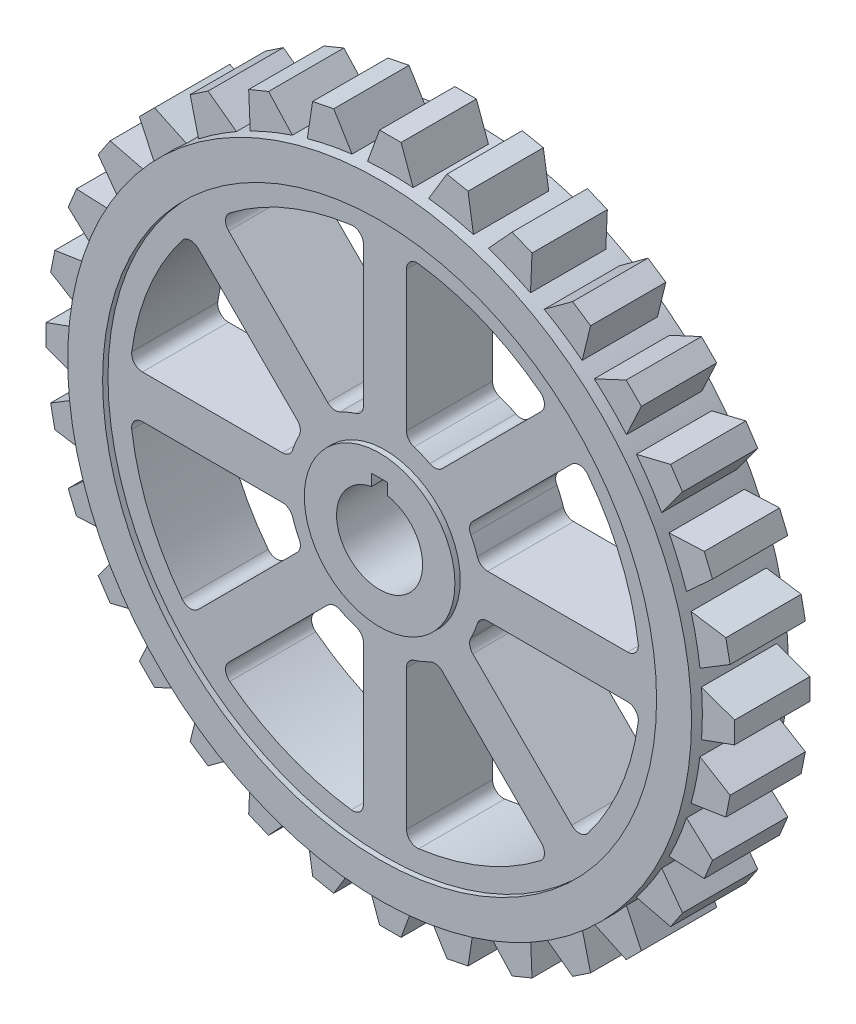
from build123d import *

# Parameters (mm, degrees)
SKETCH1_R           = 58
SKETCH1_R_2         = 51.5
BOSS_EXTRUDE2_DEPTH = 9
SKETCH1_4_R         = 51.5
SKETCH1_4_R_2       = 14
BOSS_EXTRUDE3_DEPTH = 8
SKETCH1_5_R         = 14
BOSS_EXTRUDE4_DEPTH = 9
BOSS_EXTRUDE5_DEPTH = 7
FILLET1_R           = 2


with BuildPart() as part:
    # Sketch1 → Boss-Extrude2 (new, symmetric)
    with BuildSketch(Plane.XY):
        Circle(SKETCH1_R)
        Circle(SKETCH1_R_2, mode=Mode.SUBTRACT)
    extrude(amount=BOSS_EXTRUDE2_DEPTH, both=True)

    # Sketch1<4> → Boss-Extrude3 (add, symmetric)
    with BuildSketch(Plane.XY):
        Circle(SKETCH1_4_R)
        with BuildLine():
            Line((4, 17.549928775), (4, 47.331279298))
            ThreePointArc((4, 47.331279298), (18.177463037, 43.884277794), (30.639841429, 36.296695679))
            Line((30.639841429, 36.296695679), (9.581246521, 15.238100771))
            ThreePointArc((9.581246521, 15.238100771), (6.888301783, 16.629831585), (4, 17.549928775))
        make_face(mode=Mode.SUBTRACT)
        with BuildLine():
            Line((-4, 47.331279298), (-4, 17.549928775))
            ThreePointArc((-4, 17.549928775), (-6.888301783, 16.629831585), (-9.581246521, 15.238100771))
            Line((-9.581246521, 15.238100771), (-30.639841429, 36.296695679))
            ThreePointArc((-30.639841429, 36.296695679), (-18.177463037, 43.884277794), (-4, 47.331279298))
        make_face(mode=Mode.SUBTRACT)
        with BuildLine():
            ThreePointArc((-47.331279298, 4), (-43.884277794, 18.177463037), (-36.296695679, 30.639841429))
            Line((-36.296695679, 30.639841429), (-15.238100771, 9.581246521))
            ThreePointArc((-15.238100771, 9.581246521), (-16.629831585, 6.888301783), (-17.549928775, 4))
            Line((-17.549928775, 4), (-47.331279298, 4))
        make_face(mode=Mode.SUBTRACT)
        with BuildLine():
            ThreePointArc((-36.296695679, -30.639841429), (-43.884277794, -18.177463037), (-47.331279298, -4))
            Line((-47.331279298, -4), (-17.549928775, -4))
            ThreePointArc((-17.549928775, -4), (-16.629831585, -6.888301783), (-15.238100771, -9.581246521))
            Line((-15.238100771, -9.581246521), (-36.296695679, -30.639841429))
        make_face(mode=Mode.SUBTRACT)
        with BuildLine():
            ThreePointArc((-4, -47.331279298), (-18.177463037, -43.884277794), (-30.639841429, -36.296695679))
            Line((-30.639841429, -36.296695679), (-9.581246521, -15.238100771))
            ThreePointArc((-9.581246521, -15.238100771), (-6.888301783, -16.629831585), (-4, -17.549928775))
            Line((-4, -17.549928775), (-4, -47.331279298))
        make_face(mode=Mode.SUBTRACT)
        with BuildLine():
            ThreePointArc((30.639841429, -36.296695679), (18.177463037, -43.884277794), (4, -47.331279298))
            Line((4, -47.331279298), (4, -17.549928775))
            ThreePointArc((4, -17.549928775), (6.888301783, -16.629831585), (9.581246521, -15.238100771))
            Line((9.581246521, -15.238100771), (30.639841429, -36.296695679))
        make_face(mode=Mode.SUBTRACT)
        with BuildLine():
            ThreePointArc((47.331279298, -4), (43.884277794, -18.177463037), (36.296695679, -30.639841429))
            Line((36.296695679, -30.639841429), (15.238100771, -9.581246521))
            ThreePointArc((15.238100771, -9.581246521), (16.629831585, -6.888301783), (17.549928775, -4))
            Line((17.549928775, -4), (47.331279298, -4))
        make_face(mode=Mode.SUBTRACT)
        with BuildLine():
            ThreePointArc((36.296695679, 30.639841429), (43.884277794, 18.177463037), (47.331279298, 4))
            Line((47.331279298, 4), (17.549928775, 4))
            ThreePointArc((17.549928775, 4), (16.629831585, 6.888301783), (15.238100771, 9.581246521))
            Line((15.238100771, 9.581246521), (36.296695679, 30.639841429))
        make_face(mode=Mode.SUBTRACT)
        Circle(SKETCH1_4_R_2, mode=Mode.SUBTRACT)
    extrude(amount=BOSS_EXTRUDE3_DEPTH, both=True)

    # Sketch1<5> → Boss-Extrude4 (add, symmetric)
    with BuildSketch(Plane.XY):
        Circle(SKETCH1_5_R)
        with BuildLine():
            Line((1.5, 10), (1.5, 7.858116823))
            ThreePointArc((1.5, 7.858116823), (0, -8), (-1.5, 7.858116823))
            Line((-1.5, 7.858116823), (-1.5, 10))
            Line((-1.5, 10), (1.5, 10))
        make_face(mode=Mode.SUBTRACT)
    extrude(amount=BOSS_EXTRUDE4_DEPTH, both=True)

    # Sketch4 → Boss-Extrude5 (add, symmetric)
    with BuildSketch(Plane.XY):
        with BuildLine():
            Line((-2, 64), (-4.240313182, 57.844790121))
            ThreePointArc((-4.240313182, 57.844790121), (0, 58), (4.240313182, 57.844790121))
            Line((4.240313182, 57.844790121), (2, 64))
            Line((2, 64), (-2, 64))
        make_face()
        with BuildLine():
            ThreePointArc((-15.443795485, 55.906074634), (-11.315238677, 56.885546263), (-7.126121979, 57.560562763))
            Line((-7.126121979, 57.560562763), (-10.524210048, 63.16043859))
            Line((-10.524210048, 63.16043859), (-14.44735117, 62.380077302))
            Line((-14.44735117, 62.380077302), (-15.443795485, 55.906074634))
        make_face()
        with BuildLine():
            Line((10.524210048, 63.16043859), (7.126121979, 57.560562763))
            ThreePointArc((7.126121979, 57.560562763), (11.315238677, 56.885546263), (15.443795485, 55.906074634))
            Line((15.443795485, 55.906074634), (14.44735117, 62.380077302))
            Line((14.44735117, 62.380077302), (10.524210048, 63.16043859))
        make_face()
        with BuildLine():
            ThreePointArc((-26.053781388, 51.818920052), (-22.195639077, 53.585012886), (-18.218704268, 55.064315258))
            Line((-18.218704268, 55.064315258), (-22.643980606, 59.893656945))
            Line((-22.643980606, 59.893656945), (-26.339498736, 58.362923216))
            Line((-26.339498736, 58.362923216), (-26.053781388, 51.818920052))
        make_face()
        with BuildLine():
            Line((22.643980606, 59.893656945), (18.218704268, 55.064315258))
            ThreePointArc((18.218704268, 55.064315258), (22.195639077, 53.585012886), (26.053781388, 51.818920052))
            Line((26.053781388, 51.818920052), (26.339498736, 58.362923216))
            Line((26.339498736, 58.362923216), (22.643980606, 59.893656945))
        make_face()
        with BuildLine():
            ThreePointArc((-35.662535084, 45.740393433), (-32.223073515, 48.225237514), (-28.611151969, 50.451976998))
            Line((-28.611151969, 50.451976998), (-33.893555689, 54.325195653))
            Line((-33.893555689, 54.325195653), (-37.219434138, 52.102914721))
            Line((-37.219434138, 52.102914721), (-35.662535084, 45.740393433))
        make_face()
        with BuildLine():
            Line((33.893555689, 54.325195653), (28.611151969, 50.451976998))
            ThreePointArc((28.611151969, 50.451976998), (32.223073515, 48.225237514), (35.662535084, 45.740393433))
            Line((35.662535084, 45.740393433), (37.219434138, 52.102914721))
            Line((37.219434138, 52.102914721), (33.893555689, 54.325195653))
        make_face()
        with BuildLine():
            ThreePointArc((-43.900797556, 37.904089146), (-41.012193309, 41.012193309), (-37.904089146, 43.900797556))
            Line((-37.904089146, 43.900797556), (-43.840620434, 46.669047558))
            Line((-43.840620434, 46.669047558), (-46.669047558, 43.840620434))
            Line((-46.669047558, 43.840620434), (-43.900797556, 37.904089146))
        make_face()
        with BuildLine():
            Line((43.840620434, 46.669047558), (37.904089146, 43.900797556))
            ThreePointArc((37.904089146, 43.900797556), (41.012193309, 41.012193309), (43.900797556, 37.904089146))
            Line((43.900797556, 37.904089146), (46.669047558, 43.840620434))
            Line((46.669047558, 43.840620434), (43.840620434, 46.669047558))
        make_face()
        with BuildLine():
            ThreePointArc((-50.451976998, 28.611151969), (-48.225237514, 32.223073515), (-45.740393433, 35.662535084))
            Line((-45.740393433, 35.662535084), (-52.102914721, 37.219434138))
            Line((-52.102914721, 37.219434138), (-54.325195653, 33.893555689))
            Line((-54.325195653, 33.893555689), (-50.451976998, 28.611151969))
        make_face()
        with BuildLine():
            Line((52.102914721, 37.219434138), (45.740393433, 35.662535084))
            ThreePointArc((45.740393433, 35.662535084), (48.225237514, 32.223073515), (50.451976998, 28.611151969))
            Line((50.451976998, 28.611151969), (54.325195653, 33.893555689))
            Line((54.325195653, 33.893555689), (52.102914721, 37.219434138))
        make_face()
        with BuildLine():
            ThreePointArc((-55.064315258, 18.218704268), (-53.585012886, 22.195639077), (-51.818920052, 26.053781388))
            Line((-51.818920052, 26.053781388), (-58.362923216, 26.339498736))
            Line((-58.362923216, 26.339498736), (-59.893656945, 22.643980606))
            Line((-59.893656945, 22.643980606), (-55.064315258, 18.218704268))
        make_face()
        with BuildLine():
            Line((58.362923216, 26.339498736), (51.818920052, 26.053781388))
            ThreePointArc((51.818920052, 26.053781388), (53.585012886, 22.195639077), (55.064315258, 18.218704268))
            Line((55.064315258, 18.218704268), (59.893656945, 22.643980606))
            Line((59.893656945, 22.643980606), (58.362923216, 26.339498736))
        make_face()
        with BuildLine():
            ThreePointArc((-57.560562763, 7.126121979), (-56.885546263, 11.315238677), (-55.906074634, 15.443795485))
            Line((-55.906074634, 15.443795485), (-62.380077302, 14.44735117))
            Line((-62.380077302, 14.44735117), (-63.16043859, 10.524210048))
            Line((-63.16043859, 10.524210048), (-57.560562763, 7.126121979))
        make_face()
        with BuildLine():
            Line((62.380077302, 14.44735117), (55.906074634, 15.443795485))
            ThreePointArc((55.906074634, 15.443795485), (56.885546263, 11.315238677), (57.560562763, 7.126121979))
            Line((57.560562763, 7.126121979), (63.16043859, 10.524210048))
            Line((63.16043859, 10.524210048), (62.380077302, 14.44735117))
        make_face()
        with BuildLine():
            ThreePointArc((-57.844790121, -4.240313182), (-58, 0), (-57.844790121, 4.240313182))
            Line((-57.844790121, 4.240313182), (-64, 2))
            Line((-64, 2), (-64, -2))
            Line((-64, -2), (-57.844790121, -4.240313182))
        make_face()
        with BuildLine():
            Line((64, 2), (57.844790121, 4.240313182))
            ThreePointArc((57.844790121, 4.240313182), (58, 0), (57.844790121, -4.240313182))
            Line((57.844790121, -4.240313182), (64, -2))
            Line((64, -2), (64, 2))
        make_face()
        with BuildLine():
            ThreePointArc((-55.906074634, -15.443795485), (-56.885546263, -11.315238677), (-57.560562763, -7.126121979))
            Line((-57.560562763, -7.126121979), (-63.16043859, -10.524210048))
            Line((-63.16043859, -10.524210048), (-62.380077302, -14.44735117))
            Line((-62.380077302, -14.44735117), (-55.906074634, -15.443795485))
        make_face()
        with BuildLine():
            Line((63.16043859, -10.524210048), (57.560562763, -7.126121979))
            ThreePointArc((57.560562763, -7.126121979), (56.885546263, -11.315238677), (55.906074634, -15.443795485))
            Line((55.906074634, -15.443795485), (62.380077302, -14.44735117))
            Line((62.380077302, -14.44735117), (63.16043859, -10.524210048))
        make_face()
        with BuildLine():
            ThreePointArc((-51.818920052, -26.053781388), (-53.585012886, -22.195639077), (-55.064315258, -18.218704268))
            Line((-55.064315258, -18.218704268), (-59.893656945, -22.643980606))
            Line((-59.893656945, -22.643980606), (-58.362923216, -26.339498736))
            Line((-58.362923216, -26.339498736), (-51.818920052, -26.053781388))
        make_face()
        with BuildLine():
            Line((59.893656945, -22.643980606), (55.064315258, -18.218704268))
            ThreePointArc((55.064315258, -18.218704268), (53.585012886, -22.195639077), (51.818920052, -26.053781388))
            Line((51.818920052, -26.053781388), (58.362923216, -26.339498736))
            Line((58.362923216, -26.339498736), (59.893656945, -22.643980606))
        make_face()
        with BuildLine():
            ThreePointArc((-45.740393433, -35.662535084), (-48.225237514, -32.223073515), (-50.451976998, -28.611151969))
            Line((-50.451976998, -28.611151969), (-54.325195653, -33.893555689))
            Line((-54.325195653, -33.893555689), (-52.102914721, -37.219434138))
            Line((-52.102914721, -37.219434138), (-45.740393433, -35.662535084))
        make_face()
        with BuildLine():
            Line((54.325195653, -33.893555689), (50.451976998, -28.611151969))
            ThreePointArc((50.451976998, -28.611151969), (48.225237514, -32.223073515), (45.740393433, -35.662535084))
            Line((45.740393433, -35.662535084), (52.102914721, -37.219434138))
            Line((52.102914721, -37.219434138), (54.325195653, -33.893555689))
        make_face()
        with BuildLine():
            ThreePointArc((-37.904089146, -43.900797556), (-41.012193309, -41.012193309), (-43.900797556, -37.904089146))
            Line((-43.900797556, -37.904089146), (-46.669047558, -43.840620434))
            Line((-46.669047558, -43.840620434), (-43.840620434, -46.669047558))
            Line((-43.840620434, -46.669047558), (-37.904089146, -43.900797556))
        make_face()
        with BuildLine():
            Line((46.669047558, -43.840620434), (43.900797556, -37.904089146))
            ThreePointArc((43.900797556, -37.904089146), (41.012193309, -41.012193309), (37.904089146, -43.900797556))
            Line((37.904089146, -43.900797556), (43.840620434, -46.669047558))
            Line((43.840620434, -46.669047558), (46.669047558, -43.840620434))
        make_face()
        with BuildLine():
            ThreePointArc((-28.611151969, -50.451976998), (-32.223073515, -48.225237514), (-35.662535084, -45.740393433))
            Line((-35.662535084, -45.740393433), (-37.219434138, -52.102914721))
            Line((-37.219434138, -52.102914721), (-33.893555689, -54.325195653))
            Line((-33.893555689, -54.325195653), (-28.611151969, -50.451976998))
        make_face()
        with BuildLine():
            Line((37.219434138, -52.102914721), (35.662535084, -45.740393433))
            ThreePointArc((35.662535084, -45.740393433), (32.223073515, -48.225237514), (28.611151969, -50.451976998))
            Line((28.611151969, -50.451976998), (33.893555689, -54.325195653))
            Line((33.893555689, -54.325195653), (37.219434138, -52.102914721))
        make_face()
        with BuildLine():
            ThreePointArc((-18.218704268, -55.064315258), (-22.195639077, -53.585012886), (-26.053781388, -51.818920052))
            Line((-26.053781388, -51.818920052), (-26.339498736, -58.362923216))
            Line((-26.339498736, -58.362923216), (-22.643980606, -59.893656945))
            Line((-22.643980606, -59.893656945), (-18.218704268, -55.064315258))
        make_face()
        with BuildLine():
            Line((26.339498736, -58.362923216), (26.053781388, -51.818920052))
            ThreePointArc((26.053781388, -51.818920052), (22.195639077, -53.585012886), (18.218704268, -55.064315258))
            Line((18.218704268, -55.064315258), (22.643980606, -59.893656945))
            Line((22.643980606, -59.893656945), (26.339498736, -58.362923216))
        make_face()
        with BuildLine():
            ThreePointArc((-7.126121979, -57.560562763), (-11.315238677, -56.885546263), (-15.443795485, -55.906074634))
            Line((-15.443795485, -55.906074634), (-14.44735117, -62.380077302))
            Line((-14.44735117, -62.380077302), (-10.524210048, -63.16043859))
            Line((-10.524210048, -63.16043859), (-7.126121979, -57.560562763))
        make_face()
        with BuildLine():
            Line((14.44735117, -62.380077302), (15.443795485, -55.906074634))
            ThreePointArc((15.443795485, -55.906074634), (11.315238677, -56.885546263), (7.126121979, -57.560562763))
            Line((7.126121979, -57.560562763), (10.524210048, -63.16043859))
            Line((10.524210048, -63.16043859), (14.44735117, -62.380077302))
        make_face()
        with BuildLine():
            ThreePointArc((4.240313182, -57.844790121), (0, -58), (-4.240313182, -57.844790121))
            Line((-4.240313182, -57.844790121), (-2, -64))
            Line((-2, -64), (2, -64))
            Line((2, -64), (4.240313182, -57.844790121))
        make_face()
    extrude(amount=BOSS_EXTRUDE5_DEPTH, both=True)

    # Fillet1
    fillet1_edges = [part.edges().sort_by_distance(p)[0] for p in [
        (-47.331279298, -4, 0),
        (-36.296695679, -30.639841429, 0),
        (-15.238100771, -9.581246521, 0),
        (-17.549928775, -4, 0),
        (-9.581246521, -15.238100771, 0),
        (-4, -17.549928775, 0),
        (-30.639841429, -36.296695679, 0),
        (-4, -47.331279298, 0),
        (30.639841429, -36.296695679, 0),
        (4, -47.331279298, 0),
        (9.581246521, -15.238100771, 0),
        (4, -17.549928775, 0),
        (36.296695679, -30.639841429, 0),
        (15.238100771, -9.581246521, 0),
        (17.549928775, -4, 0),
        (47.331279298, -4, 0),
        (17.549928775, 4, 0),
        (47.331279298, 4, 0),
        (15.238100771, 9.581246521, 0),
        (36.296695679, 30.639841429, 0),
        (30.639841429, 36.296695679, 0),
        (4, 47.331279298, 0),
        (9.581246521, 15.238100771, 0),
        (4, 17.549928775, 0),
        (-4, 17.549928775, 0),
        (-4, 47.331279298, 0),
        (-9.581246521, 15.238100771, 0),
        (-30.639841429, 36.296695679, 0),
        (-15.238100771, 9.581246521, 0),
        (-17.549928775, 4, 0),
        (-36.296695679, 30.639841429, 0),
        (-47.331279298, 4, 0),
    ]]
    fillet(fillet1_edges, radius=FILLET1_R)


solid = part.part
